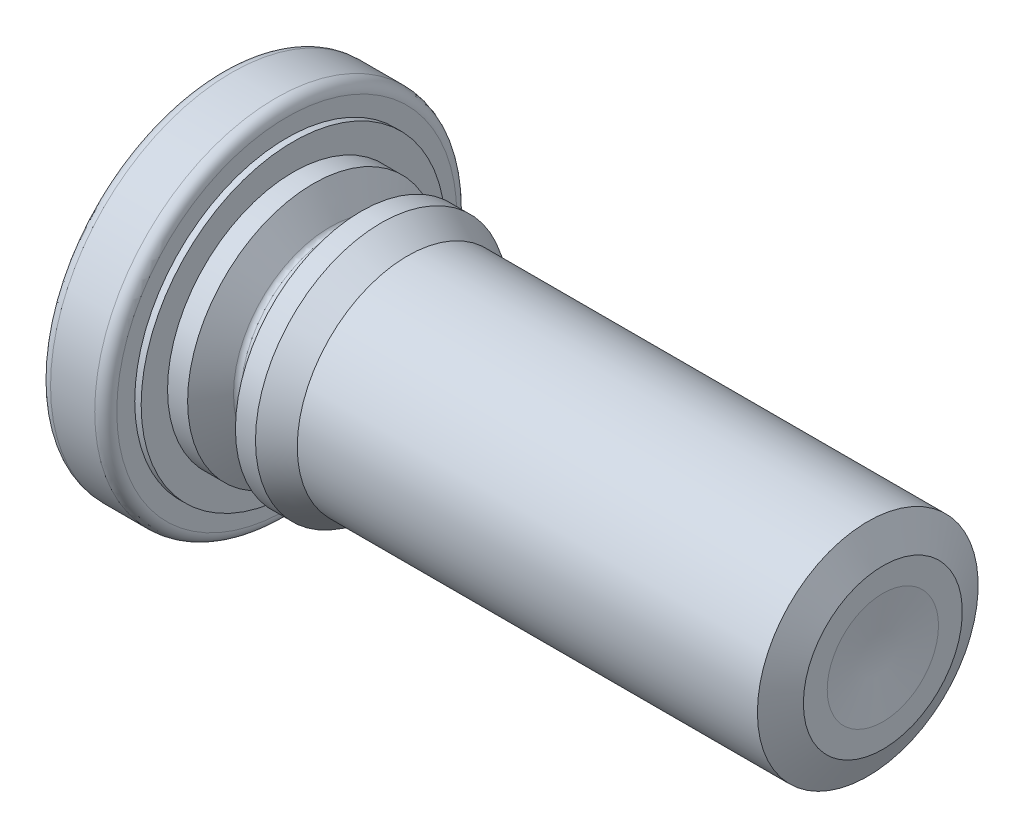
from build123d import *

# Parameters (mm, degrees)
FILLET1_R = 0.15875
FILLET2_R = 0.079375


with BuildPart() as part:
    # Sketch1 → Revolve1 (revolve)
    with BuildSketch(Plane.XY):
        Polygon((-4.7625, 0), (-4.7625, 2.6035), (-3.81, 2.6035), (-3.81, 2.18694), (-3.717429994, 2.18694), (-3.717429994, 1.807470453), (-3.429, 1.807470453), (-3.164518467, 1.349375), (-3.005768467, 1.349375), (-2.741286934, 1.807470453), (-2.45285694, 1.807470453), (-2.07185694, 1.5875), (4.545702864, 1.5875), (4.7625, 1.143), (4.7625, 0.8001), (4.654101432, 0), align=None)
    revolve(axis=Axis((-4.7625, 0, 0), (1, 0, 0)))

    # Fillet1
    fillet1_edges = [part.edges().sort_by_distance(p)[0] for p in [
        (-3.81, -2.6035, 0),
        (-4.7625, -2.6035, 0),
    ]]
    fillet(fillet1_edges, radius=FILLET1_R)

    # Fillet2
    fillet2_edges = [part.edges().sort_by_distance(p)[0] for p in [
        (-3.164518467, -1.349375, 0),
        (-3.005768467, -1.349375, 0),
    ]]
    fillet(fillet2_edges, radius=FILLET2_R)


solid = part.part
